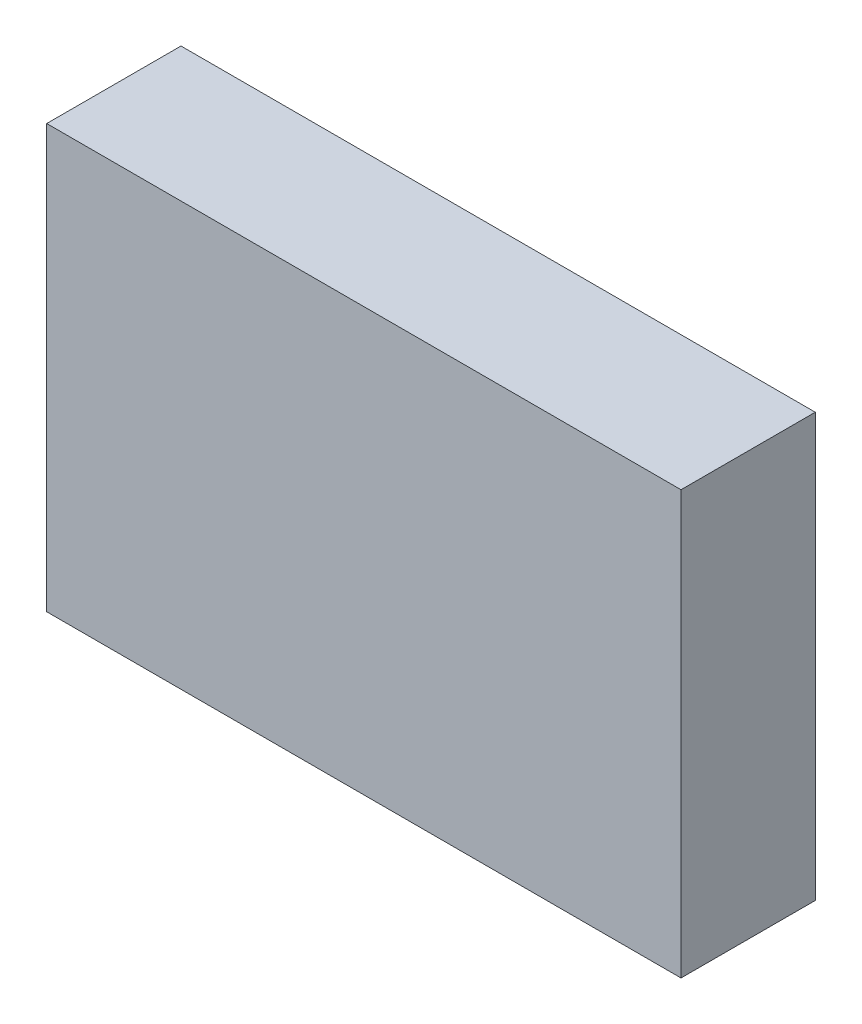
from build123d import *

# Parameters (mm, degrees)
SKETCH1_W           = 120
SKETCH1_H           = 80
BOSS_EXTRUDE1_DEPTH = 25.4


with BuildPart() as part:
    # Sketch1 → Boss-Extrude1 (new body)
    with BuildSketch(Plane.XY):
        Rectangle(SKETCH1_W, SKETCH1_H)
    extrude(amount=BOSS_EXTRUDE1_DEPTH)


solid = part.part
